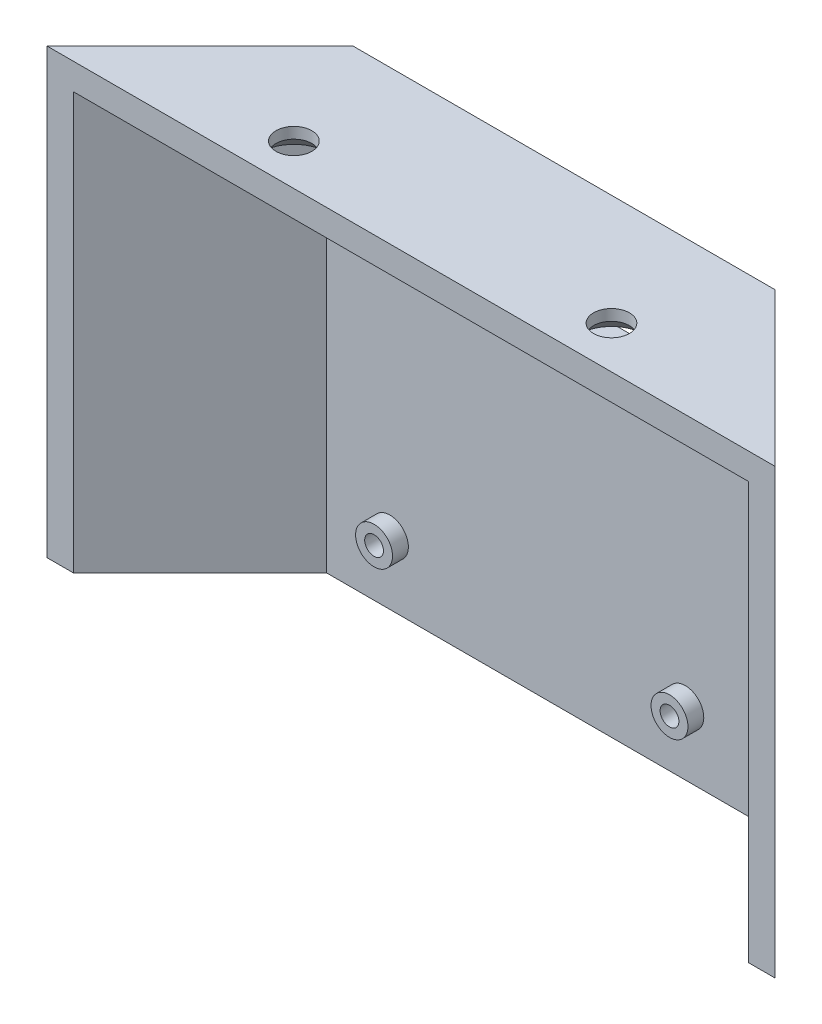
from build123d import *

# Parameters (mm, degrees)
SKETCH1_W                                      = 40
SKETCH1_H                                      = 42
BOSS_EXTRUDE1_DEPTH                            = 2.5
SKETCH2_W                                      = 40
SKETCH2_H                                      = 2.5
BOSS_EXTRUDE2_DEPTH                            = 12
SKETCH3_R                                      = 1.75
BOSS_EXTRUDE3_DEPTH                            = 1.5
SKETCH5_R                                      = 0.89
CUT_EXTRUDE2_DEPTH                             = 31.842341027
SKETCH6_W                                      = 10
SKETCH6_H                                      = 5
CUT_EXTRUDE3_DEPTH                             = 31.842341027
CSK_FOR_M3_FLAT_HEAD_MACHINE_SCREW1_AT_2_COUNT = 2
CSK_FOR_M3_FLAT_HEAD_MACHINE_SCREW1_AT_2_PITCH = 30
BOSS_EXTRUDE4_DEPTH                            = 2.5
BOSS_EXTRUDE5_DEPTH                            = 39.5
BODY_MOVE_COPY1_ANGLE                          = 90


with BuildPart() as part:
    # Sketch1 → Boss-Extrude1 (new body)
    with BuildSketch(Plane(origin=(0, 0, 0), x_dir=(1, 0, 0), z_dir=(0, 1, 0))):
        Rectangle(SKETCH1_W, SKETCH1_H)
    extrude(amount=BOSS_EXTRUDE1_DEPTH)

    # Sketch2 → Boss-Extrude2 (add)
    with BuildSketch(Plane(origin=(0, 2.5, 0), x_dir=(1, 0, 0), z_dir=(0, 1, 0))):
        with Locations((0, 19.75)):
            Rectangle(SKETCH2_W, SKETCH2_H)
    extrude(amount=BOSS_EXTRUDE2_DEPTH)

    # Sketch3 → Boss-Extrude3 (add)
    with BuildSketch(Plane(origin=(0, 2.5, 0), x_dir=(1, 0, 0), z_dir=(0, 1, 0))):
        with Locations(Location((14, 13, 0), (0, 0, 90))):
            Circle(SKETCH3_R)
        with Locations(Location((-14, 13, 0), (0, 0, 90))):
            Circle(SKETCH3_R)
        with Locations(Location((-14, -15, 0), (0, 0, 90))):
            Circle(SKETCH3_R)
        with Locations(Location((14, -15, 0), (0, 0, 90))):
            Circle(SKETCH3_R)
    extrude(amount=BOSS_EXTRUDE3_DEPTH)

    # Sketch5 → Cut-Extrude2 (cut, through all)
    with BuildSketch(Plane(origin=(0, 4, 0), x_dir=(1, 0, 0), z_dir=(0, 1, 0))):
        with Locations(Location((-14, 13, 0), (0, 0, 270))):
            Circle(SKETCH5_R)
        with Locations(Location((14, 13, 0), (0, 0, 270))):
            Circle(SKETCH5_R)
        with Locations(Location((14, -15, 0), (0, 0, 270))):
            Circle(SKETCH5_R)
        with Locations(Location((-14, -15, 0), (0, 0, 270))):
            Circle(SKETCH5_R)
    extrude(amount=-CUT_EXTRUDE2_DEPTH, mode=Mode.SUBTRACT)

    # Sketch6 → Cut-Extrude3 (cut, through all)
    with BuildSketch(Plane(origin=(0, 4, 0), x_dir=(1, 0, 0), z_dir=(0, 1, 0))):
        with Locations((7.25, 13)):
            Rectangle(SKETCH6_W, SKETCH6_H)
    extrude(amount=-CUT_EXTRUDE3_DEPTH, mode=Mode.SUBTRACT)

    # Sketch8 → CSK for M3 Flat Head Machine Screw1 (revolve, cut)
    with BuildSketch(Plane(origin=(-15, 10.59833188, -18.5), x_dir=(0, -1, 0), z_dir=(1, 0, 0))):
        Polygon((0, 0), (0, 2.5), (1.7, 2.5), (1.7, 1.45), (3.15, 0), align=None)
    csk_for_m3_flat_head_machine_screw1 = revolve(axis=Axis((-15, 10.59833188, -12.15), (0, 0, -1)), mode=Mode.SUBTRACT)

    # CSK for M3 Flat Head Machine Screw1 at 2: CSK for M3 Flat Head Machine Screw1 ×2
    with Locations(*[Vector(0.9999946282308037, -0.0032777293263655718, 0) * (i * CSK_FOR_M3_FLAT_HEAD_MACHINE_SCREW1_AT_2_PITCH) for i in range(1, CSK_FOR_M3_FLAT_HEAD_MACHINE_SCREW1_AT_2_COUNT)]):
        add(csk_for_m3_flat_head_machine_screw1, mode=Mode.SUBTRACT)

    # Sketch9 → Boss-Extrude4 (add)
    with BuildSketch(Plane(origin=(0, 0, -21), x_dir=(-1, 0, 0), z_dir=(0, 0, -1))):
        Polygon((20, 0), (34.5, 14.5), (20, 14.5), align=None)
        Polygon((-20, 0), (-34.5, 14.5), (-20, 14.5), align=None)
    extrude(amount=-BOSS_EXTRUDE4_DEPTH)

    # Sketch10 → Boss-Extrude5 (add)
    with BuildSketch(Plane.XY.offset(-18.5)):
        Polygon((20, 2.5), (32, 14.5), (34.5, 14.5), (20, 0), align=None)
        Polygon((-20, 2.5), (-32, 14.5), (-34.5, 14.5), (-20, 0), align=None)
    extrude(amount=BOSS_EXTRUDE5_DEPTH)


with BuildPart() as part_1:
    # Body-Move/Copy1: moved
    add(part.part.rotate(Axis((0, 0, 0), (1, 0, 0)), BODY_MOVE_COPY1_ANGLE))


solid = part_1.part
